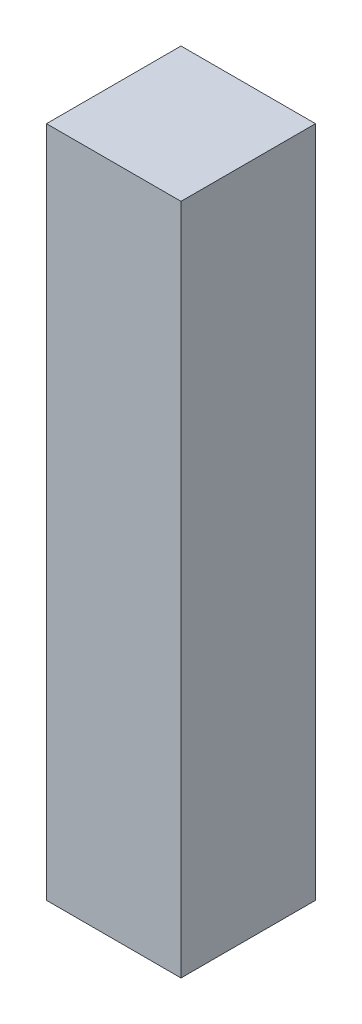
from build123d import *

# Parameters (mm, degrees)
SKETCH1_W           = 8
SKETCH1_H           = 8
BOSS_EXTRUDE1_DEPTH = 40


with BuildPart() as part:
    # Sketch1 → Boss-Extrude1 (new body)
    with BuildSketch(Plane(origin=(0, 0, 0), x_dir=(1, 0, 0), z_dir=(0, 1, 0))):
        Rectangle(SKETCH1_W, SKETCH1_H)
    extrude(amount=BOSS_EXTRUDE1_DEPTH)


solid = part.part
